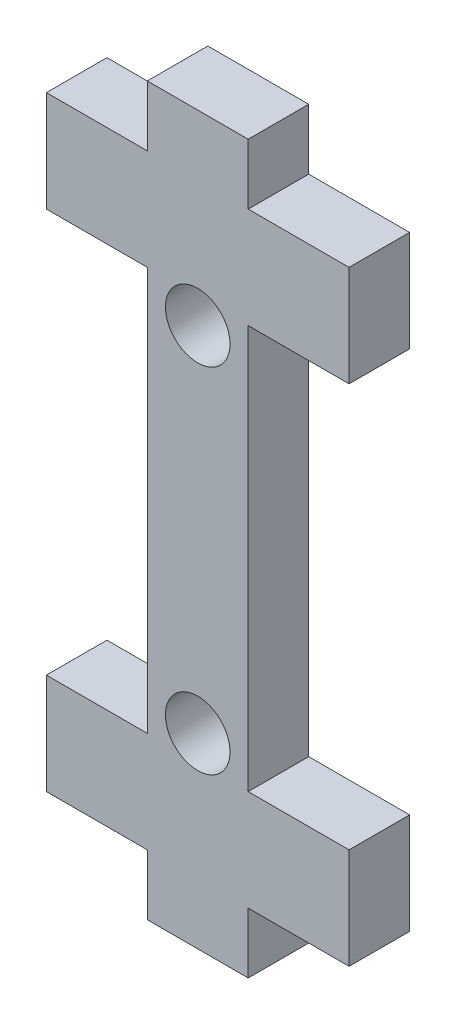
from build123d import *

# Parameters (mm, degrees)
SKETCH1_R           = 1.6
BOSS_EXTRUDE1_DEPTH = 3


with BuildPart() as part:
    # Sketch1 → Boss-Extrude1 (new body)
    with BuildSketch(Plane.XY):
        Polygon((-2.5, 15), (-2.5, 18), (2.5, 18), (2.5, 15), (7.5, 15), (7.5, 10), (2.5, 10), (2.5, -10), (7.5, -10), (7.5, -15), (2.5, -15), (2.5, -18), (-2.5, -18), (-2.5, -15), (-7.5, -15), (-7.5, -10), (-2.5, -10), (-2.5, 10), (-7.5, 10), (-7.5, 15), align=None)
        with Locations((0, 8.75)):
            Circle(SKETCH1_R, mode=Mode.SUBTRACT)
        with Locations(Location((0, -8.75, 0), (0, 0, 180))):
            Circle(SKETCH1_R, mode=Mode.SUBTRACT)
    extrude(amount=BOSS_EXTRUDE1_DEPTH)


solid = part.part
